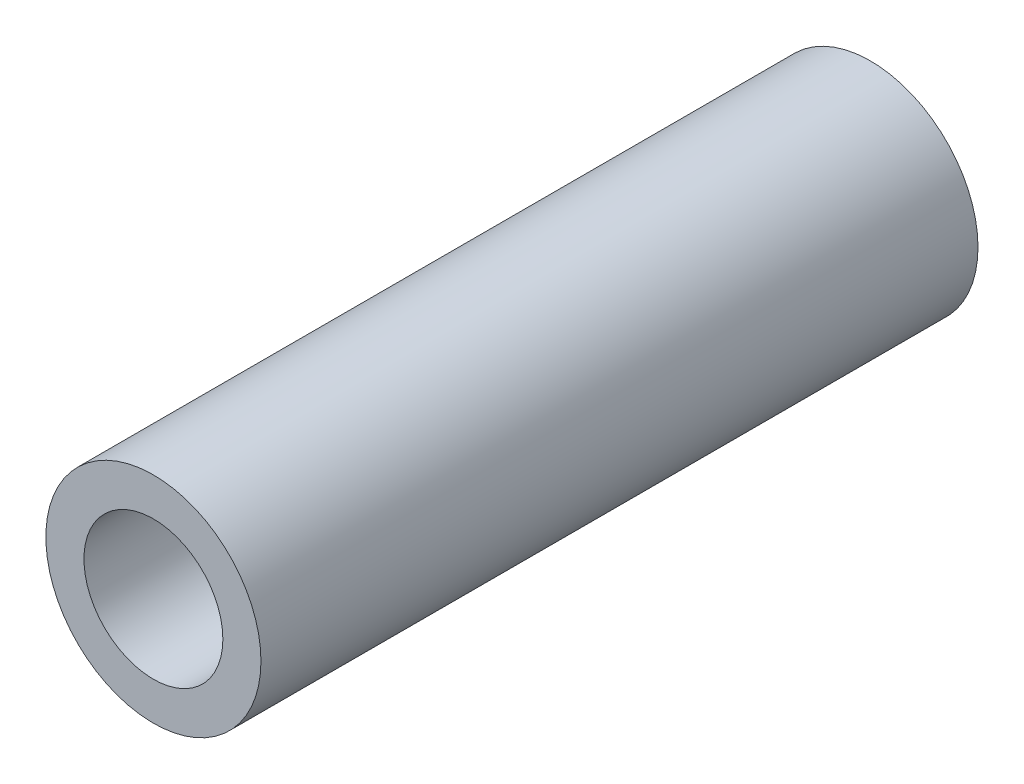
from build123d import *

# Parameters (mm, degrees)
SKETCH1_R           = 2.4
SKETCH1_R_2         = 1.55
BOSS_EXTRUDE1_DEPTH = 16


with BuildPart() as part:
    # Sketch1 → Boss-Extrude1 (new body)
    with BuildSketch(Plane.XY):
        with Locations((-33.892990188, 10.670311674)):
            Circle(SKETCH1_R)
        with Locations((-33.892990188, 10.670311674)):
            Circle(SKETCH1_R_2, mode=Mode.SUBTRACT)
    extrude(amount=BOSS_EXTRUDE1_DEPTH)


solid = part.part
